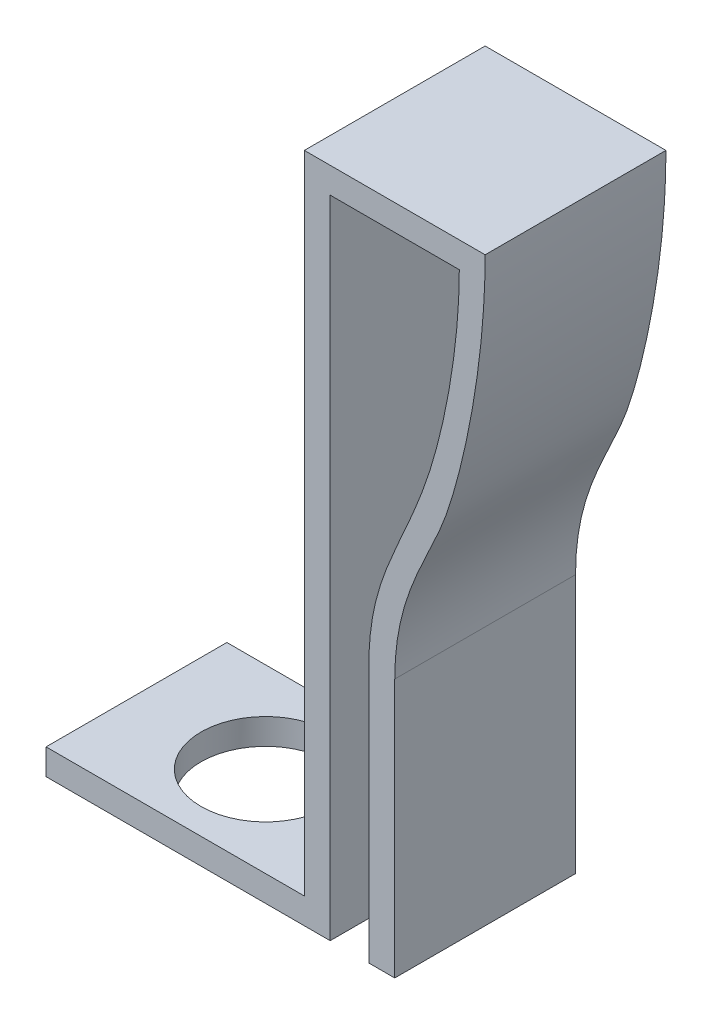
from build123d import *

# Parameters (mm, degrees)
BOSS_EXTRUDE1_DEPTH = 7
SKETCH5_R           = 2.5
CUT_EXTRUDE1_DEPTH  = 7


with BuildPart() as part:
    # Sketch1 → Boss-Extrude1 (new body)
    with BuildSketch(Plane.XY):
        with BuildLine():
            Line((0, 0), (0, 25))
            Line((0, 25), (5, 25))
            add(Edge.make_bspline(
                [(5, 25), (5, 22.505160854), (3.775153637, 15.544027487), (1.5, 13.160240213), (1.5, 10)],
                knots=[0, 0, 0, 0, 0.413095148, 1, 1, 1, 1], degree=3))
            Line((1.5, 10), (1.5, 0))
            Line((1.5, 0), (2.5, 0))
            Line((2.5, 0), (2.5, 10.023972807))
            add(Edge.make_bspline(
                [(6, 26), (6, 22.322385343), (5.041275268, 17.971400198), (3.790776866, 14.65259624), (2.5, 12.696926019), (2.5, 10.023972807)],
                knots=[0, 0, 0, 0, 0.426693592, 0.526693592, 1, 1, 1, 1], degree=3))
            Line((6, 26), (-1, 26))
            Line((-1, 26), (-1, 1))
            Line((-1, 1), (-11, 1))
            Line((-11, 1), (-11, 0))
            Line((-11, 0), (-1, 0))
            Line((-1, 0), (0, 0))
        make_face()
    extrude(amount=BOSS_EXTRUDE1_DEPTH)

    # Sketch5 → Cut-Extrude1 (cut)
    with BuildSketch(Plane(origin=(0, 1, 0), x_dir=(1, 0, 0), z_dir=(0, 1, 0))):
        with Locations(Location((-6, -3.5, 0), (0, 0, 270))):
            Circle(SKETCH5_R)
    extrude(amount=-CUT_EXTRUDE1_DEPTH, mode=Mode.SUBTRACT)


solid = part.part
